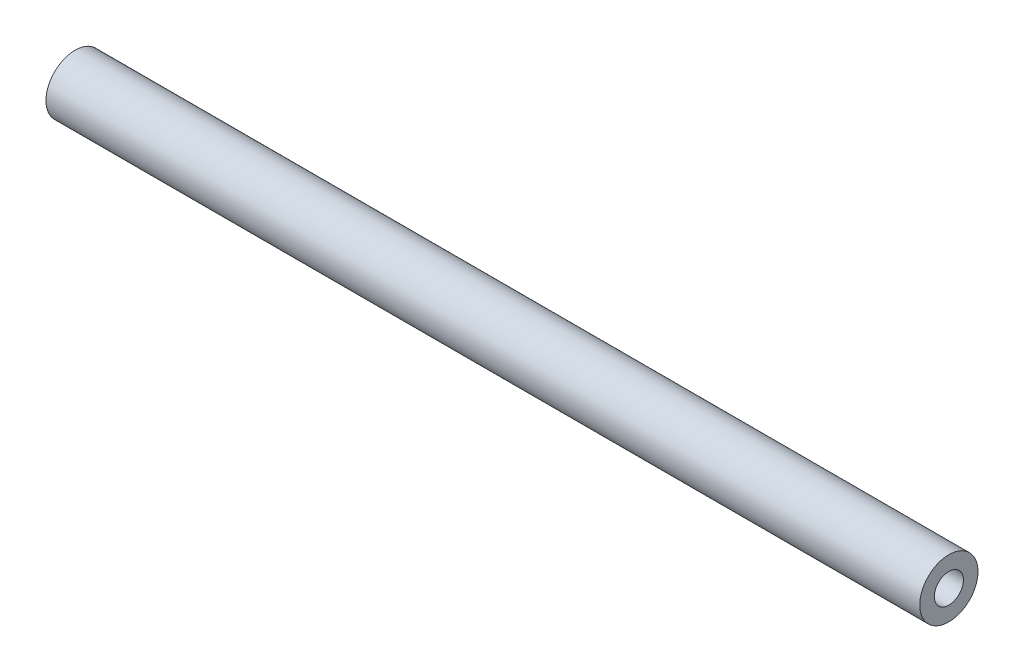
from build123d import *

# Parameters (mm, degrees)
SKETCH1_R           = 5
SKETCH1_R_2         = 2.5
BOSS_EXTRUDE1_DEPTH = 75


with BuildPart() as part:
    # Sketch1 → Boss-Extrude1 (new, symmetric)
    with BuildSketch(Plane(origin=(0, 0, 0), x_dir=(0, 0, -1), z_dir=(1, 0, 0))):
        Circle(SKETCH1_R)
        Circle(SKETCH1_R_2, mode=Mode.SUBTRACT)
    extrude(amount=BOSS_EXTRUDE1_DEPTH, both=True)


solid = part.part
